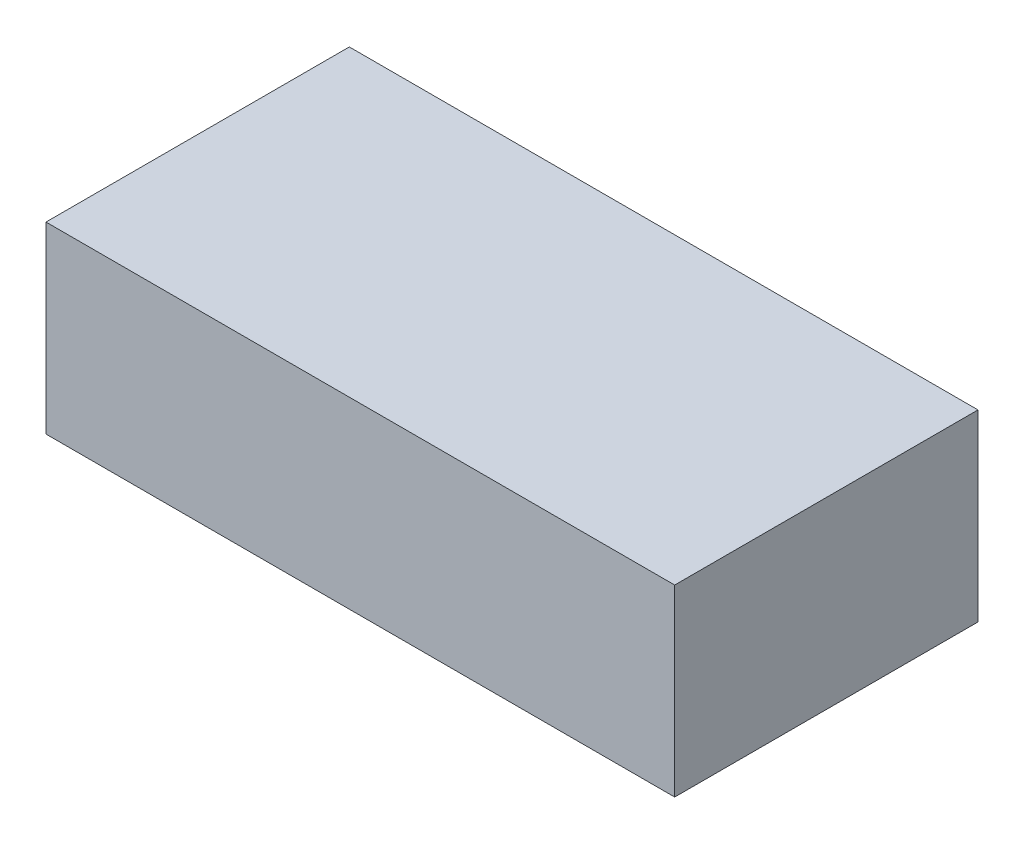
from build123d import *

# Parameters (mm, degrees)
SKETCH1_W           = 72.39
SKETCH1_H           = 34.925
BOSS_EXTRUDE1_DEPTH = 21.1455


with BuildPart() as part:
    # Sketch1 → Boss-Extrude1 (new body)
    with BuildSketch(Plane(origin=(0, 0, 0), x_dir=(1, 0, 0), z_dir=(0, 1, 0))):
        Rectangle(SKETCH1_W, SKETCH1_H)
    extrude(amount=BOSS_EXTRUDE1_DEPTH)


solid = part.part
